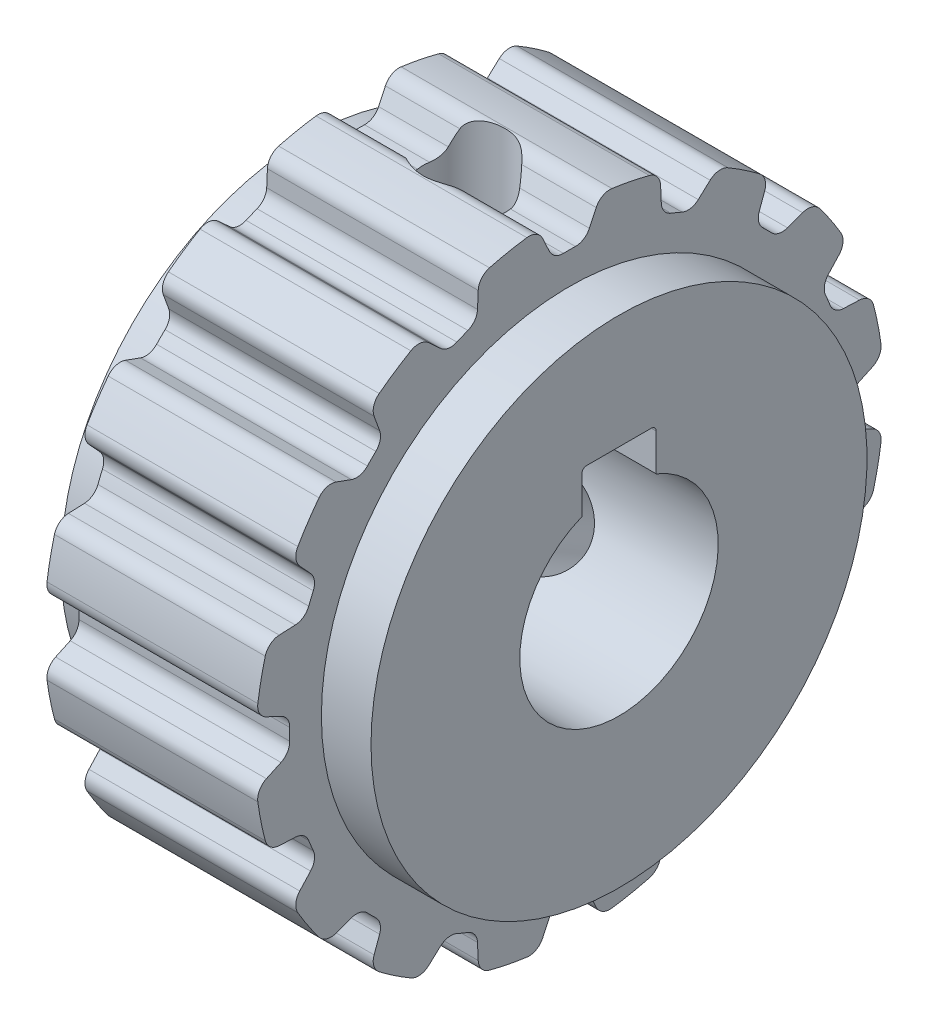
from build123d import *

# Parameters (mm, degrees)
CUT_EXTRUDE1_DEPTH  = 21.780153994
CIRPATTERN1_COUNT   = 16
TAPPED_HOLE1_REACH  = 32.85
TAPPED_HOLE1_BORE_R = 1.65
CIRPATTERN2_COUNT   = 2
CIRPATTERN2_ANGLE   = 120
CUT_EXTRUDE2_DEPTH  = 22.730403029


with BuildPart() as part:
    # Sketch1 → Revolve1 (revolve)
    with BuildSketch(Plane.XY, mode=Mode.PRIVATE) as revolve1_sk:
        Polygon((0, 4), (12.5, 4), (12.5, 10), (10.5, 10), (10.5, 12.68), (2, 12.68), (2, 10), (0, 10), align=None)
    revolve(revolve1_sk.sketch.rotate(Axis((0, 0, 0), (1, 0, 0)), 90), axis=Axis((0, 0, 0), (1, 0, 0)))

    # Sketch2 → Cut-Extrude1 (cut, through all)
    with BuildSketch(Plane.ZY.offset(-2)):
        with BuildLine():
            Line((-0.806316069, 11.629500863), (-1.080185063, 12.216814818))
            ThreePointArc((-1.080185063, 12.216814818), (-1.340917612, 12.494525576), (-1.715563884, 12.563408795))
            ThreePointArc((-1.715563884, 12.563408795), (0, 12.68), (1.715563884, 12.563408795))
            ThreePointArc((1.715563884, 12.563408795), (1.340917612, 12.494525576), (1.080185063, 12.216814818))
            Line((1.080185063, 12.216814818), (0.806316069, 11.629500863))
            ThreePointArc((0.806316069, 11.629500863), (0.575718483, 11.369364772), (0.240464477, 11.277436625))
            ThreePointArc((0.240464477, 11.277436625), (0, 11.28), (-0.240464477, 11.277436625))
            ThreePointArc((-0.240464477, 11.277436625), (-0.575718483, 11.369364772), (-0.806316069, 11.629500863))
        make_face()
    cut_extrude1 = extrude(amount=-CUT_EXTRUDE1_DEPTH, mode=Mode.SUBTRACT)

    # CirPattern1: Cut-Extrude1 ×16 about axis
    cirpattern1_axis = Axis((0, 0, 0), (1, 0, 0))
    for i in range(1, CIRPATTERN1_COUNT):
        add(cut_extrude1.rotate(cirpattern1_axis, i * 360 / CIRPATTERN1_COUNT), mode=Mode.SUBTRACT)

    # Tapped Hole1 bore → Tapped Hole1 (cut, up to next)
    with BuildSketch(Plane(origin=(0, 12.68, 0), x_dir=(1, 0, 0), z_dir=(0, 1, 0)), mode=Mode.PRIVATE) as tapped_hole1_sk1:
        with Locations((6.25, 0)):
            Circle(TAPPED_HOLE1_BORE_R)
    tapped_hole1_tool1 = extrude(tapped_hole1_sk1.sketch, amount=-TAPPED_HOLE1_REACH, mode=Mode.PRIVATE) & part.part
    tapped_hole1 = tapped_hole1_tool1.solids().sort_by_distance((6.25, 12.68, 0))[0]
    add(tapped_hole1, mode=Mode.SUBTRACT)

    # CirPattern2: Tapped Hole1; each copy of Tapped Hole1 runs up to whatever stops it at its own place
    cirpattern2_before = part.part  # the part as the pattern finds it: every copy runs up to it
    cirpattern2_tapped_hole1_long = extrude(tapped_hole1_sk1.sketch, amount=-TAPPED_HOLE1_REACH, mode=Mode.PRIVATE)
    cirpattern2_tapped_hole1_tool1 = cirpattern2_tapped_hole1_long.rotate(Axis((0, 0, 0), (-1, 0, 0)), 1 * CIRPATTERN2_ANGLE / (CIRPATTERN2_COUNT - 1)) & cirpattern2_before
    add(cirpattern2_tapped_hole1_tool1.solids().sort_by_distance((6.25, -6.34, -10.981202))[0], mode=Mode.SUBTRACT)

    # Sketch5 → Cut-Extrude2 (cut, through all)
    with BuildSketch(Plane(origin=(0, 0, 0), x_dir=(0, 0, -1), z_dir=(1, 0, 0))):
        with BuildLine():
            Line((-1.5, 0), (1.5, 0))
            Line((1.5, 0), (1.5, 5.2))
            ThreePointArc((1.5, 5.2), (1.441421356, 5.341421356), (1.3, 5.4))
            Line((1.3, 5.4), (-1.3, 5.4))
            ThreePointArc((-1.3, 5.4), (-1.441421356, 5.341421356), (-1.5, 5.2))
            Line((-1.5, 5.2), (-1.5, 0))
        make_face()
    extrude(amount=CUT_EXTRUDE2_DEPTH, mode=Mode.SUBTRACT)


solid = part.part
